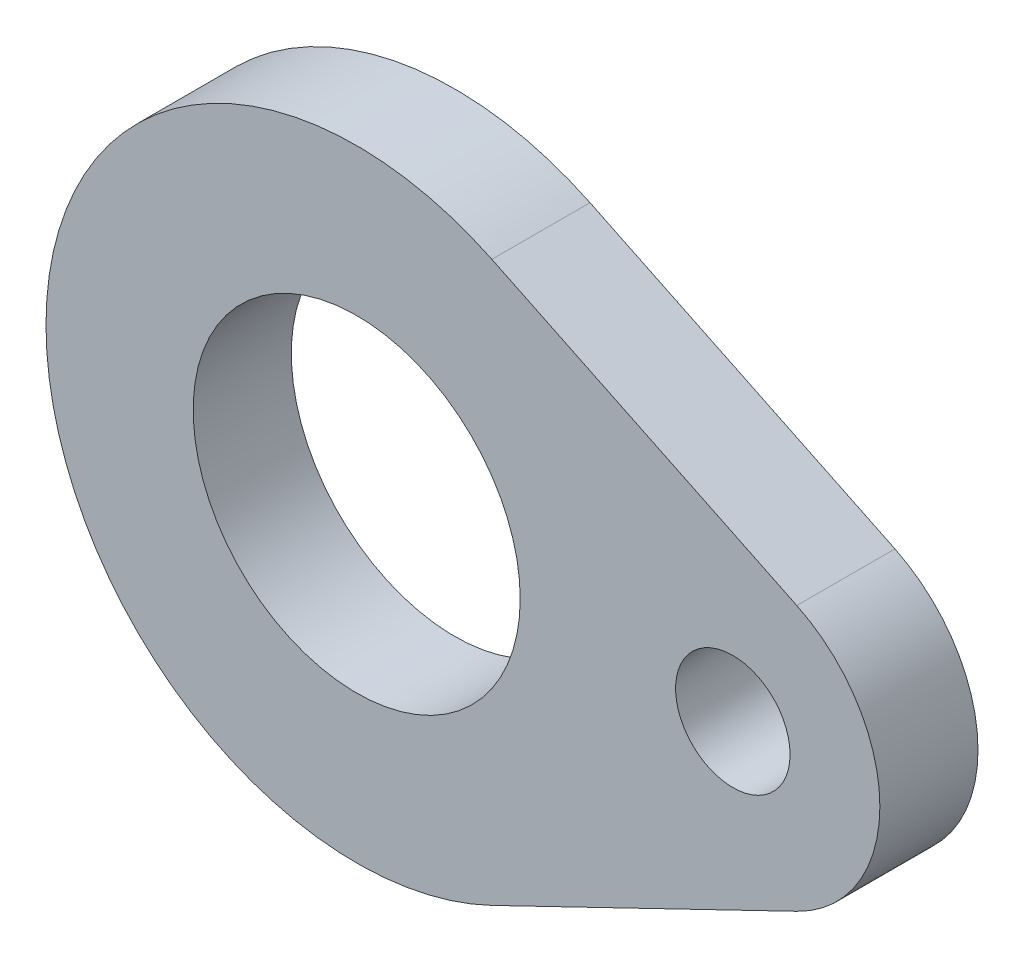
from build123d import *

# Parameters (mm, degrees)
SKETCH1_R           = 5
SKETCH1_R_2         = 1.75
BOSS_EXTRUDE1_DEPTH = 1.5


with BuildPart() as part:
    # Sketch1 → Boss-Extrude1 (new, symmetric)
    with BuildSketch(Plane.XY):
        with BuildLine():
            Line((4.133217888, 8.55374245), (13.456374273, 4.048739292))
            ThreePointArc((13.456374273, 4.048739292), (15.996630978, 0), (13.456374273, -4.048739292))
            Line((13.456374273, -4.048739292), (4.133217888, -8.55374245))
            ThreePointArc((4.133217888, -8.55374245), (-9.5, 0), (4.133217888, 8.55374245))
        make_face()
        Circle(SKETCH1_R, mode=Mode.SUBTRACT)
        with Locations((11.5, 0)):
            Circle(SKETCH1_R_2, mode=Mode.SUBTRACT)
    extrude(amount=BOSS_EXTRUDE1_DEPTH, both=True)


solid = part.part
